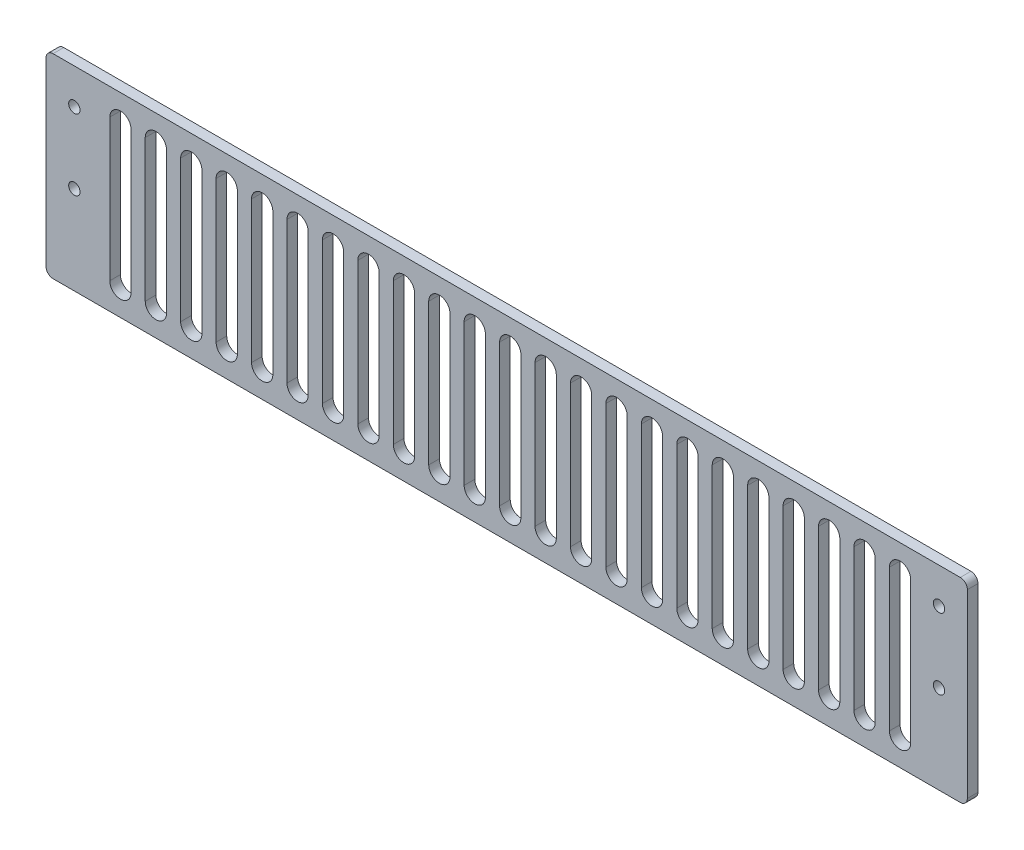
from build123d import *

# Parameters (mm, degrees)
SKETCH_1_W          = 260
SKETCH_1_H          = 55
EXTRUDE_1_DEPTH     = 3
FILLET_1_R          = 2
SKETCH_2_R          = 1.6
CUT_EXTRUDE_1_DEPTH = 18
CUT_EXTRUDE_2_DEPTH = 10


with BuildPart() as part:
    # 草图1 → 凸台-拉伸1 (new body)
    with BuildSketch(Plane.XY):
        Rectangle(SKETCH_1_W, SKETCH_1_H)
    extrude(amount=EXTRUDE_1_DEPTH)

    # 圆角1
    fillet_1_edges = [part.edges().sort_by_distance(p)[0] for p in [
        (-130, 27.5, 1.5),
        (130, 27.5, 1.5),
        (130, -27.5, 1.5),
        (-130, -27.5, 1.5),
    ]]
    fillet(fillet_1_edges, radius=FILLET_1_R)

    # 草图2 → 切除-拉伸1 (cut)
    with BuildSketch(Plane.XY.offset(3)):
        with Locations((-122, 17.5)):
            Circle(SKETCH_2_R)
        with Locations((-122, -2.5)):
            Circle(SKETCH_2_R)
        with Locations((122, -2.5)):
            Circle(SKETCH_2_R)
        with Locations((122, 17.5)):
            Circle(SKETCH_2_R)
    extrude(amount=-CUT_EXTRUDE_1_DEPTH, mode=Mode.SUBTRACT)

    # 草图3 → 切除-拉伸2 (cut)
    with BuildSketch(Plane.XY.offset(3)):
        with BuildLine():
            Line((-106, 20), (-106, -20))
            ThreePointArc((-106, -20), (-109, -23), (-112, -20))
            Line((-112, -20), (-112, 20))
            ThreePointArc((-112, 20), (-109, 23), (-106, 20))
        make_face()
        with BuildLine():
            Line((-96, 20), (-96, -20))
            ThreePointArc((-96, -20), (-99, -23), (-102, -20))
            Line((-102, -20), (-102, 20))
            ThreePointArc((-102, 20), (-99, 23), (-96, 20))
        make_face()
        with BuildLine():
            Line((-86, 20), (-86, -20))
            ThreePointArc((-86, -20), (-89, -23), (-92, -20))
            Line((-92, -20), (-92, 20))
            ThreePointArc((-92, 20), (-89, 23), (-86, 20))
        make_face()
        with BuildLine():
            Line((-76, 20), (-76, -20))
            ThreePointArc((-76, -20), (-79, -23), (-82, -20))
            Line((-82, -20), (-82, 20))
            ThreePointArc((-82, 20), (-79, 23), (-76, 20))
        make_face()
        with BuildLine():
            Line((-66, 20), (-66, -20))
            ThreePointArc((-66, -20), (-69, -23), (-72, -20))
            Line((-72, -20), (-72, 20))
            ThreePointArc((-72, 20), (-69, 23), (-66, 20))
        make_face()
        with BuildLine():
            Line((-56, 20), (-56, -20))
            ThreePointArc((-56, -20), (-59, -23), (-62, -20))
            Line((-62, -20), (-62, 20))
            ThreePointArc((-62, 20), (-59, 23), (-56, 20))
        make_face()
        with BuildLine():
            Line((-46, 20), (-46, -20))
            ThreePointArc((-46, -20), (-49, -23), (-52, -20))
            Line((-52, -20), (-52, 20))
            ThreePointArc((-52, 20), (-49, 23), (-46, 20))
        make_face()
        with BuildLine():
            Line((-36, 20), (-36, -20))
            ThreePointArc((-36, -20), (-39, -23), (-42, -20))
            Line((-42, -20), (-42, 20))
            ThreePointArc((-42, 20), (-39, 23), (-36, 20))
        make_face()
        with BuildLine():
            Line((-26, 20), (-26, -20))
            ThreePointArc((-26, -20), (-29, -23), (-32, -20))
            Line((-32, -20), (-32, 20))
            ThreePointArc((-32, 20), (-29, 23), (-26, 20))
        make_face()
        with BuildLine():
            Line((-16, 20), (-16, -20))
            ThreePointArc((-16, -20), (-19, -23), (-22, -20))
            Line((-22, -20), (-22, 20))
            ThreePointArc((-22, 20), (-19, 23), (-16, 20))
        make_face()
        with BuildLine():
            Line((-6, 20), (-6, -20))
            ThreePointArc((-6, -20), (-9, -23), (-12, -20))
            Line((-12, -20), (-12, 20))
            ThreePointArc((-12, 20), (-9, 23), (-6, 20))
        make_face()
        with BuildLine():
            Line((4, 20), (4, -20))
            ThreePointArc((4, -20), (1, -23), (-2, -20))
            Line((-2, -20), (-2, 20))
            ThreePointArc((-2, 20), (1, 23), (4, 20))
        make_face()
        with BuildLine():
            Line((14, 20), (14, -20))
            ThreePointArc((14, -20), (11, -23), (8, -20))
            Line((8, -20), (8, 20))
            ThreePointArc((8, 20), (11, 23), (14, 20))
        make_face()
        with BuildLine():
            Line((24, 20), (24, -20))
            ThreePointArc((24, -20), (21, -23), (18, -20))
            Line((18, -20), (18, 20))
            ThreePointArc((18, 20), (21, 23), (24, 20))
        make_face()
        with BuildLine():
            Line((34, 20), (34, -20))
            ThreePointArc((34, -20), (31, -23), (28, -20))
            Line((28, -20), (28, 20))
            ThreePointArc((28, 20), (31, 23), (34, 20))
        make_face()
        with BuildLine():
            Line((44, 20), (44, -20))
            ThreePointArc((44, -20), (41, -23), (38, -20))
            Line((38, -20), (38, 20))
            ThreePointArc((38, 20), (41, 23), (44, 20))
        make_face()
        with BuildLine():
            Line((54, 20), (54, -20))
            ThreePointArc((54, -20), (51, -23), (48, -20))
            Line((48, -20), (48, 20))
            ThreePointArc((48, 20), (51, 23), (54, 20))
        make_face()
        with BuildLine():
            Line((64, 20), (64, -20))
            ThreePointArc((64, -20), (61, -23), (58, -20))
            Line((58, -20), (58, 20))
            ThreePointArc((58, 20), (61, 23), (64, 20))
        make_face()
        with BuildLine():
            Line((74, 20), (74, -20))
            ThreePointArc((74, -20), (71, -23), (68, -20))
            Line((68, -20), (68, 20))
            ThreePointArc((68, 20), (71, 23), (74, 20))
        make_face()
        with BuildLine():
            Line((84, 20), (84, -20))
            ThreePointArc((84, -20), (81, -23), (78, -20))
            Line((78, -20), (78, 20))
            ThreePointArc((78, 20), (81, 23), (84, 20))
        make_face()
        with BuildLine():
            Line((94, 20), (94, -20))
            ThreePointArc((94, -20), (91, -23), (88, -20))
            Line((88, -20), (88, 20))
            ThreePointArc((88, 20), (91, 23), (94, 20))
        make_face()
        with BuildLine():
            Line((104, 20), (104, -20))
            ThreePointArc((104, -20), (101, -23), (98, -20))
            Line((98, -20), (98, 20))
            ThreePointArc((98, 20), (101, 23), (104, 20))
        make_face()
        with BuildLine():
            Line((114, 20), (114, -20))
            ThreePointArc((114, -20), (111, -23), (108, -20))
            Line((108, -20), (108, 20))
            ThreePointArc((108, 20), (111, 23), (114, 20))
        make_face()
    extrude(amount=-CUT_EXTRUDE_2_DEPTH, mode=Mode.SUBTRACT)


solid = part.part
